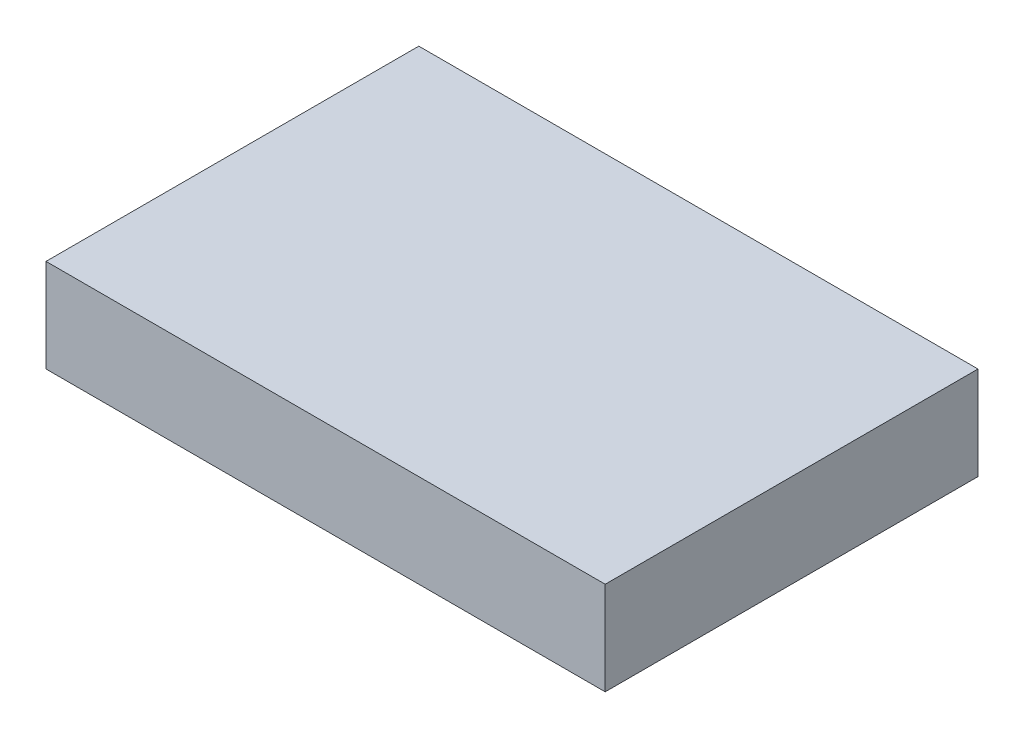
from build123d import *

# Parameters (mm, degrees)
SKETCH4_W      = 76.2
SKETCH4_H      = 50.8
EXTRUDE2_DEPTH = 12.7


with BuildPart() as part:
    # Sketch4 → Extrude2 (new body)
    with BuildSketch(Plane(origin=(0, 0, 0), x_dir=(1, 0, 0), z_dir=(0, 1, 0))):
        with Locations((38.1, 25.4)):
            Rectangle(SKETCH4_W, SKETCH4_H)
    extrude(amount=-EXTRUDE2_DEPTH)


solid = part.part
